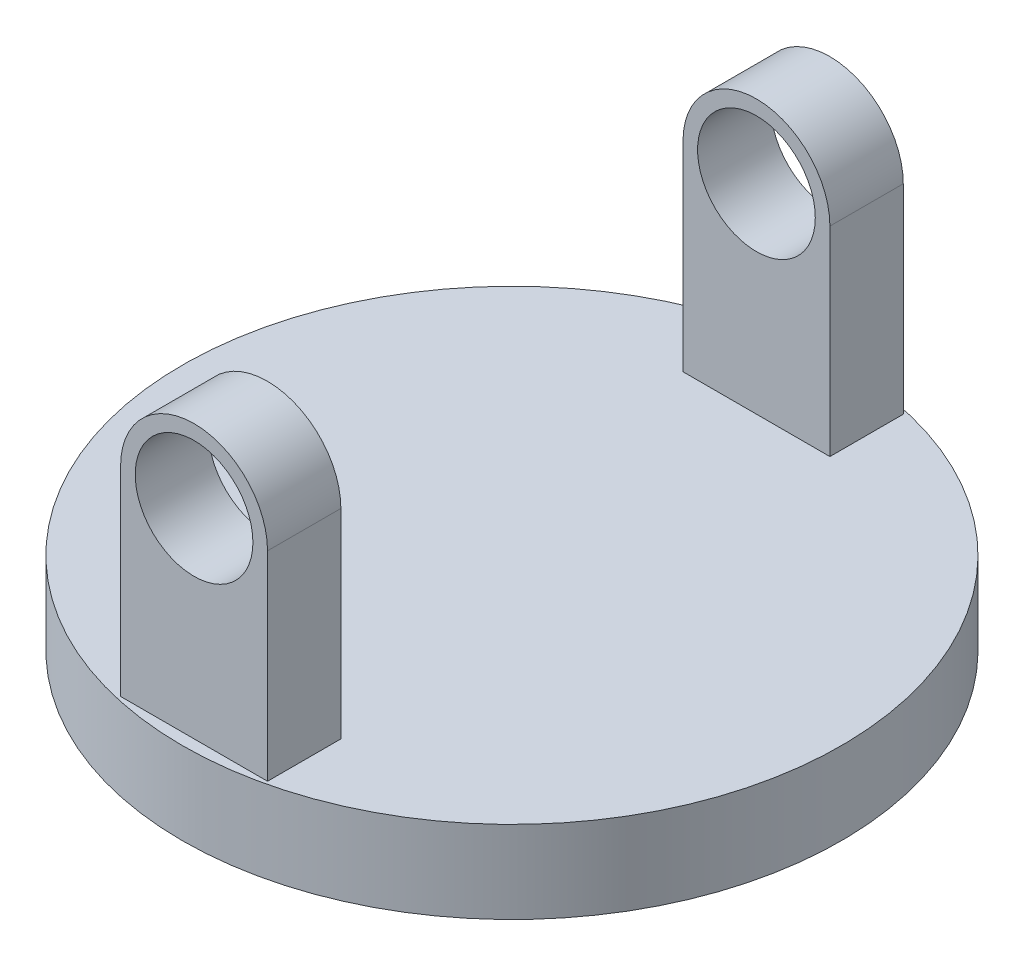
from build123d import *

# Parameters (mm, degrees)
SKETCH1_R           = 28
BOSS_EXTRUDE1_DEPTH = 7
BOSS_EXTRUDE2_START = -1.226475693
SKETCH4_R           = 5
BOSS_EXTRUDE2_DEPTH = 6.232399738


with BuildPart() as part:
    # Sketch1 → Boss-Extrude1 (new body)
    with BuildSketch(Plane(origin=(0, 0, 0), x_dir=(1, 0, 0), z_dir=(0, 1, 0))):
        with Locations(Location((0, 0, 0), (0, 0, 270))):
            Circle(SKETCH1_R)
    extrude(amount=BOSS_EXTRUDE1_DEPTH)

    # Sketch4 → Boss-Extrude2 (add)
    with BuildSketch(Plane.XY.offset(22).offset(BOSS_EXTRUDE2_START)):
        with BuildLine():
            Line((-6.241476895, 15.467624234), (-6.241476895, 7))
            ThreePointArc((-6.241476895, 7), (0, 5.970563029), (6.241476895, 7))
            Line((6.241476895, 7), (6.241476895, 15.467624234))
            Line((6.241476895, 15.467624234), (6.241476895, 23.956480862))
            ThreePointArc((6.241476895, 23.956480862), (0, 30.197957757), (-6.241476895, 23.956480862))
            Line((-6.241476895, 23.956480862), (-6.241476895, 15.467624234))
        make_face()
        with Locations((0, 23.956480862)):
            Circle(SKETCH4_R, mode=Mode.SUBTRACT)
    boss_extrude2 = extrude(amount=BOSS_EXTRUDE2_DEPTH)

    # Mirror1: Boss-Extrude2 across plane
    add(boss_extrude2.mirror(Plane.XY))


solid = part.part
